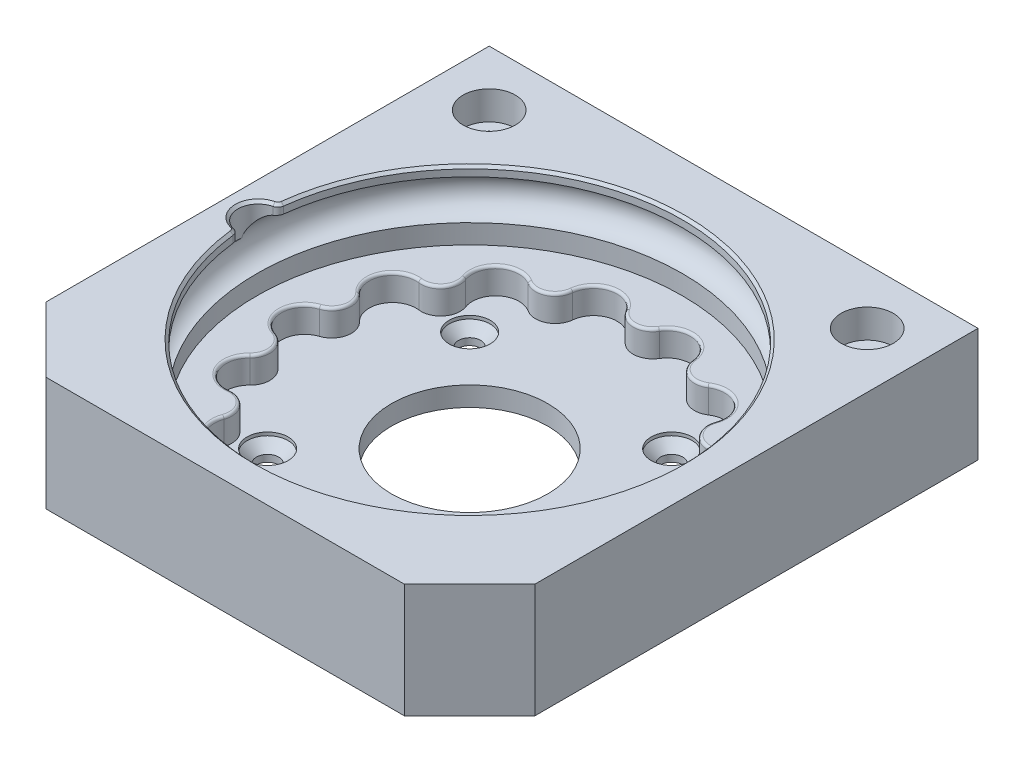
from build123d import *

# Parameters (mm, degrees)
SKETCH3_W                                           = 75
SKETCH3_H                                           = 75
SKETCH3_R                                           = 4.1
BOSS_EXTRUDE1_DEPTH                                 = 3
SKETCH4_W                                           = 75
SKETCH4_H                                           = 75
SKETCH4_R                                           = 3
BOSS_EXTRUDE2_DEPTH                                 = 4
SKETCH5_W                                           = 75
SKETCH5_H                                           = 75
SKETCH5_R                                           = 32.65
BOSS_EXTRUDE3_DEPTH                                 = 10.5
CHAMFER1_SIZE                                       = 10
SKETCH11_R                                          = 3.05
CUT_EXTRUDE2_START                                  = -4.5
SKETCH12_R                                          = 3.1
CUT_EXTRUDE2_DEPTH                                  = 4.5
FILLET2_R                                           = 1
SKETCH14_R                                          = 12
CUT_EXTRUDE3_DEPTH                                  = 56.845769925
CSK_FOR_M3_COUNTERSUNK_FLAT_HEAD_SCR_2_COUNT        = 2
CSK_FOR_M3_COUNTERSUNK_FLAT_HEAD_SCR_2_PITCH        = 31
CSK_FOR_M3_COUNTERSUNK_FLAT_HEAD_SCR_3_COUNT        = 2
CSK_FOR_M3_COUNTERSUNK_FLAT_HEAD_SCR_3_PITCH        = 43.840620434
CSK_FOR_M3_COUNTERSUNK_FLAT_HEAD_SCR_4_COUNT        = 2
CSK_FOR_M3_COUNTERSUNK_FLAT_HEAD_SCR_4_PITCH        = 31
CHAMFER2_SIZE                                       = 0.4
FILLET3_R                                           = 0.4
SKETCH24_W                                          = 75
SKETCH24_H                                          = 3
BOSS_EXTRUDE5_DEPTH                                 = 17.5
CBORE_FOR_M4_HEX_SOCKET_HEAD_CAP_SCREW1_D           = 4.5
CBORE_FOR_M4_HEX_SOCKET_HEAD_CAP_SCREW1_CBORE_D     = 8
CBORE_FOR_M4_HEX_SOCKET_HEAD_CAP_SCREW1_CBORE_DEPTH = 4.4


with BuildPart() as part:
    # Sketch3 → Boss-Extrude1 (new body)
    with BuildSketch(Plane(origin=(0, 0, 0), x_dir=(1, 0, 0), z_dir=(0, 1, 0))):
        Rectangle(SKETCH3_W, SKETCH3_H)
        with Locations(Location((0, 0, 0), (0, 0, 270))):
            Circle(SKETCH3_R, mode=Mode.SUBTRACT)
    extrude(amount=BOSS_EXTRUDE1_DEPTH)

    # Sketch4 → Boss-Extrude2 (add)
    # profile 1 of 15: a face of its own
    with BuildSketch(Plane(origin=(0, 3, 0), x_dir=(1, 0, 0), z_dir=(0, 1, 0))):
        Rectangle(SKETCH4_W, SKETCH4_H)
        with BuildLine():
            ThreePointArc((26.442208789, -3.408319866), (29.147644896, -3.81769999), (30.395474332, -6.252838244))
            ThreePointArc((30.395474332, -6.252838244), (28.561845083, -9.016817128), (25.302421485, -8.402054328))
            ThreePointArc((25.302421485, -8.402054328), (26.033152103, -12.5369053), (22.344792349, -14.543634511))
            ThreePointArc((22.344792349, -14.543634511), (24.219573885, -15.535873809), (24.969464657, -17.520063432))
            ThreePointArc((24.969464657, -17.520063432), (22.491548896, -20.474285504), (19.151179292, -18.548298619))
            ThreePointArc((19.151179292, -18.548298619), (18.015500229, -22.590722751), (13.821715745, -22.798403975))
            ThreePointArc((13.821715745, -22.798403975), (14.827351089, -23.883479748), (15.192133069, -25.317225188))
            ThreePointArc((15.192133069, -25.317225188), (12.043751311, -28.313553417), (9.206811167, -25.020824888))
            ThreePointArc((9.206811167, -25.020824888), (6.42965759, -28.170170503), (2.561078824, -26.537669928))
            ThreePointArc((2.561078824, -26.537669928), (2.888185977, -27.288592727), (3, -28.1))
            ThreePointArc((3, -28.1), (-0.811407273, -30.988185977), (-2.561078824, -26.537669928))
            ThreePointArc((-2.561078824, -26.537669928), (-6.42965759, -28.170170503), (-9.206811167, -25.020824888))
            ThreePointArc((-9.206811167, -25.020824888), (-9.195804841, -25.16884343), (-9.192133069, -25.317225188))
            ThreePointArc((-9.192133069, -25.317225188), (-13.625878509, -27.952443208), (-13.821715745, -22.798403975))
            ThreePointArc((-13.821715745, -22.798403975), (-18.015500229, -22.590722751), (-19.151179292, -18.548298619))
            ThreePointArc((-19.151179292, -18.548298619), (-24.314959105, -19.390532838), (-22.344792349, -14.543634511))
            ThreePointArc((-22.344792349, -14.543634511), (-26.033152103, -12.5369053), (-25.302421485, -8.402054328))
            ThreePointArc((-25.302421485, -8.402054328), (-30.320258069, -6.920401046), (-26.442208789, -3.408319866))
            ThreePointArc((-26.442208789, -3.408319866), (-28.894618926, 0), (-26.442208789, 3.408319866))
            ThreePointArc((-26.442208789, 3.408319866), (-30.320258069, 6.920401046), (-25.302421485, 8.402054328))
            ThreePointArc((-25.302421485, 8.402054328), (-26.033152103, 12.5369053), (-22.344792349, 14.543634511))
            ThreePointArc((-22.344792349, 14.543634511), (-24.314959105, 19.390532838), (-19.151179292, 18.548298619))
            ThreePointArc((-19.151179292, 18.548298619), (-18.015500229, 22.590722751), (-13.821715745, 22.798403975))
            ThreePointArc((-13.821715745, 22.798403975), (-13.625878509, 27.952443208), (-9.192133069, 25.317225188))
            ThreePointArc((-9.192133069, 25.317225188), (-9.195804841, 25.16884343), (-9.206811167, 25.020824888))
            ThreePointArc((-9.206811167, 25.020824888), (-6.42965759, 28.170170503), (-2.561078824, 26.537669928))
            ThreePointArc((-2.561078824, 26.537669928), (-0.811407273, 30.988185977), (3, 28.1))
            ThreePointArc((3, 28.1), (2.888185977, 27.288592727), (2.561078824, 26.537669928))
            ThreePointArc((2.561078824, 26.537669928), (6.42965759, 28.170170503), (9.206811167, 25.020824888))
            ThreePointArc((9.206811167, 25.020824888), (12.043751311, 28.313553417), (15.192133069, 25.317225188))
            ThreePointArc((15.192133069, 25.317225188), (14.827351089, 23.883479748), (13.821715745, 22.798403975))
            ThreePointArc((13.821715745, 22.798403975), (18.015500229, 22.590722751), (19.151179292, 18.548298619))
            ThreePointArc((19.151179292, 18.548298619), (22.491548896, 20.474285504), (24.969464657, 17.520063432))
            ThreePointArc((24.969464657, 17.520063432), (24.219573885, 15.535873809), (22.344792349, 14.543634511))
            ThreePointArc((22.344792349, 14.543634511), (26.033152103, 12.5369053), (25.302421485, 8.402054328))
            ThreePointArc((25.302421485, 8.402054328), (28.561845083, 9.016817128), (30.395474332, 6.252838244))
            ThreePointArc((30.395474332, 6.252838244), (29.147644896, 3.81769999), (26.442208789, 3.408319866))
            ThreePointArc((26.442208789, 3.408319866), (28.894618926, 0), (26.442208789, -3.408319866))
        make_face(mode=Mode.SUBTRACT)
    # profile 2 of 15: a face of its own
    with BuildSketch(Plane(origin=(0, 3, 0), x_dir=(1, 0, 0), z_dir=(0, 1, 0))):
        with Locations((21.969464657, 17.520063432)):
            Circle(SKETCH4_R)
    # profile 3 of 15: a face of its own
    with BuildSketch(Plane(origin=(0, 3, 0), x_dir=(1, 0, 0), z_dir=(0, 1, 0))):
        with Locations((27.395474332, 6.252838244)):
            Circle(SKETCH4_R)
    # profile 4 of 15: a face of its own
    with BuildSketch(Plane(origin=(0, 3, 0), x_dir=(1, 0, 0), z_dir=(0, 1, 0))):
        with Locations((27.395474332, -6.252838244)):
            Circle(SKETCH4_R)
    # profile 5 of 15: a face of its own
    with BuildSketch(Plane(origin=(0, 3, 0), x_dir=(1, 0, 0), z_dir=(0, 1, 0))):
        with Locations((21.969464657, -17.520063432)):
            Circle(SKETCH4_R)
    # profile 6 of 15: a face of its own
    with BuildSketch(Plane(origin=(0, 3, 0), x_dir=(1, 0, 0), z_dir=(0, 1, 0))):
        with Locations((12.192133069, -25.317225188)):
            Circle(SKETCH4_R)
    # profile 7 of 15: a face of its own
    with BuildSketch(Plane(origin=(0, 3, 0), x_dir=(1, 0, 0), z_dir=(0, 1, 0))):
        with Locations((0, -28.1)):
            Circle(SKETCH4_R)
    # profile 8 of 15: a face of its own
    with BuildSketch(Plane(origin=(0, 3, 0), x_dir=(1, 0, 0), z_dir=(0, 1, 0))):
        with Locations((-12.192133069, -25.317225188)):
            Circle(SKETCH4_R)
    # profile 9 of 15: a face of its own
    with BuildSketch(Plane(origin=(0, 3, 0), x_dir=(1, 0, 0), z_dir=(0, 1, 0))):
        with Locations((-21.969464657, -17.520063432)):
            Circle(SKETCH4_R)
    # profile 10 of 15: a face of its own
    with BuildSketch(Plane(origin=(0, 3, 0), x_dir=(1, 0, 0), z_dir=(0, 1, 0))):
        with Locations((-27.395474332, -6.252838244)):
            Circle(SKETCH4_R)
    # profile 11 of 15: a face of its own
    with BuildSketch(Plane(origin=(0, 3, 0), x_dir=(1, 0, 0), z_dir=(0, 1, 0))):
        with Locations((-27.395474332, 6.252838244)):
            Circle(SKETCH4_R)
    # profile 12 of 15: a face of its own
    with BuildSketch(Plane(origin=(0, 3, 0), x_dir=(1, 0, 0), z_dir=(0, 1, 0))):
        with Locations((-21.969464657, 17.520063432)):
            Circle(SKETCH4_R)
    # profile 13 of 15: a face of its own
    with BuildSketch(Plane(origin=(0, 3, 0), x_dir=(1, 0, 0), z_dir=(0, 1, 0))):
        with Locations((-12.192133069, 25.317225188)):
            Circle(SKETCH4_R)
    # profile 14 of 15: a face of its own
    with BuildSketch(Plane(origin=(0, 3, 0), x_dir=(1, 0, 0), z_dir=(0, 1, 0))):
        with Locations((0, 28.1)):
            Circle(SKETCH4_R)
    # profile 15 of 15: a face of its own
    with BuildSketch(Plane(origin=(0, 3, 0), x_dir=(1, 0, 0), z_dir=(0, 1, 0))):
        with Locations((12.192133069, 25.317225188)):
            Circle(SKETCH4_R)
    extrude(amount=BOSS_EXTRUDE2_DEPTH)

    # Sketch5 → Boss-Extrude3 (add)
    with BuildSketch(Plane(origin=(0, 7, 0), x_dir=(1, 0, 0), z_dir=(0, 1, 0))):
        Rectangle(SKETCH5_W, SKETCH5_H)
        with Locations(Location((0, 0, 0), (0, 0, 90))):
            Circle(SKETCH5_R, mode=Mode.SUBTRACT)
    extrude(amount=BOSS_EXTRUDE3_DEPTH)

    # Chamfer1
    chamfer1_edges = [part.edges().sort_by_distance(p)[0] for p in [
        (37.5, 8.75, 37.5),
        (-37.5, 8.75, 37.5),
    ]]
    chamfer(chamfer1_edges, length=CHAMFER1_SIZE)

    # Sketch11 → Cut-Revolve1 (revolve, cut)
    with BuildSketch(Plane.XY, mode=Mode.PRIVATE) as cut_revolve1_sk:
        with Locations((-32.45, 13)):
            Circle(SKETCH11_R)
    revolve(cut_revolve1_sk.sketch.rotate(Axis((0, 0, 0), (0, 1, 0)), 270), axis=Axis((0, 0, 0), (0, 1, 0)), mode=Mode.SUBTRACT)

    # Sketch12 → Cut-Extrude2 (cut)
    with BuildSketch(Plane(origin=(0, 17.5, 0), x_dir=(1, 0, 0), z_dir=(0, 1, 0)).offset(CUT_EXTRUDE2_START)):
        with Locations((-32.45, 0)):
            Circle(SKETCH12_R)
    extrude(amount=CUT_EXTRUDE2_DEPTH, mode=Mode.SUBTRACT)

    # Fillet2
    fillet2_edges = [part.edges().sort_by_distance(p)[0] for p in [
        (-32.502542373, 16.771717779, 3.099554694),
        (-32.502542373, 16.771717779, -3.099554694),
    ]]
    fillet(fillet2_edges, radius=FILLET2_R)

    # Sketch14 → Cut-Extrude3 (cut, through all)
    with BuildSketch(Plane.XZ):
        with Locations(Location((0, 0, 0), (0, 0, 270))):
            Circle(SKETCH14_R)
    extrude(amount=-CUT_EXTRUDE3_DEPTH, mode=Mode.SUBTRACT)

    # Sketch16 → CSK for M3 Countersunk Flat Head Screw1 (revolve, cut)
    with BuildSketch(Plane(origin=(-15.5, 3, -15.5), x_dir=(0, 0, 1), z_dir=(1, 0, 0))):
        Polygon((0, 0), (0, 3), (1.7, 3), (1.7, 1.95), (3.15, 0.5), (3.15, 0), align=None)
    csk_for_m3_countersunk_flat_head_screw1 = revolve(axis=Axis((-15.5, 9.35, -15.5), (0, -1, 0)), mode=Mode.SUBTRACT)

    # CSK for M3 Countersunk Flat Head Scr 2: CSK for M3 Countersunk Flat Head Screw1 ×2
    with Locations(*[(i * CSK_FOR_M3_COUNTERSUNK_FLAT_HEAD_SCR_2_PITCH, 0, 0) for i in range(1, CSK_FOR_M3_COUNTERSUNK_FLAT_HEAD_SCR_2_COUNT)]):
        add(csk_for_m3_countersunk_flat_head_screw1, mode=Mode.SUBTRACT)

    # CSK for M3 Countersunk Flat Head Scr 3: CSK for M3 Countersunk Flat Head Screw1 ×2
    with Locations(*[Vector(0.7071067811865476, 0, 0.7071067811865476) * (i * CSK_FOR_M3_COUNTERSUNK_FLAT_HEAD_SCR_3_PITCH) for i in range(1, CSK_FOR_M3_COUNTERSUNK_FLAT_HEAD_SCR_3_COUNT)]):
        add(csk_for_m3_countersunk_flat_head_screw1, mode=Mode.SUBTRACT)

    # CSK for M3 Countersunk Flat Head Scr 4: CSK for M3 Countersunk Flat Head Screw1 ×2
    with Locations(*[(0, 0, i * CSK_FOR_M3_COUNTERSUNK_FLAT_HEAD_SCR_4_PITCH) for i in range(1, CSK_FOR_M3_COUNTERSUNK_FLAT_HEAD_SCR_4_COUNT)]):
        add(csk_for_m3_countersunk_flat_head_screw1, mode=Mode.SUBTRACT)

    # Chamfer2
    chamfer2_edges = [part.edges().sort_by_distance(p)[0] for p in [
        (-35.55, 17.5, 0),
        (32.65, 17.5, 0),
        (-32.665461312, 17.5, -3.321237531),
        (-32.665461312, 17.5, 3.321237531),
    ]]
    chamfer(chamfer2_edges, length=CHAMFER2_SIZE)

    # Fillet3
    fillet3_edges = [part.edges().sort_by_distance(p)[0] for p in [
        (-26.033152103, 7, 12.5369053),
        (-28.894618926, 7, 0),
        (-26.033152103, 7, -12.5369053),
        (-18.015500229, 7, -22.590722751),
        (-6.42965759, 7, -28.170170503),
        (6.42965759, 7, -28.170170503),
        (18.015500229, 7, -22.590722751),
        (26.033152103, 7, -12.5369053),
        (28.894618926, 7, 0),
        (26.033152103, 7, 12.5369053),
        (18.015500229, 7, 22.590722751),
        (6.42965759, 7, 28.170170503),
        (-6.42965759, 7, 28.170170503),
        (-18.015500229, 7, 22.590722751),
        (-24.470690596, 7, 5.585275442),
        (-24.470690596, 7, -5.585275442),
        (-19.62397021, 7, -15.649594027),
        (-10.890481852, 7, -22.614318584),
        (0, 7, -25.1),
        (10.890481852, 7, -22.614318584),
        (19.62397021, 7, -15.649594027),
        (24.470690596, 7, -5.585275442),
        (24.470690596, 7, 5.585275442),
        (19.62397021, 7, 15.649594027),
        (10.890481852, 7, 22.614318584),
        (0, 7, 25.1),
        (-10.890481852, 7, 22.614318584),
        (-19.62397021, 7, 15.649594027),
    ]]
    fillet(fillet3_edges, radius=FILLET3_R)

    # Sketch24 → Boss-Extrude5 (add)
    with BuildSketch(Plane(origin=(0, 17.5, 0), x_dir=(1, 0, 0), z_dir=(0, 1, 0))):
        with Locations((0, 39)):
            Rectangle(SKETCH24_W, SKETCH24_H)
    extrude(amount=-BOSS_EXTRUDE5_DEPTH)

    # CBORE for M4 Hex Socket Head Cap Screw1 (through all)
    with Locations(Plane(origin=(0, 17.5, 0), x_dir=(1, 0, 0), z_dir=(0, 1, 0))):
        with Locations((-29, 32), (29, 32)):
            CounterBoreHole(CBORE_FOR_M4_HEX_SOCKET_HEAD_CAP_SCREW1_D / 2, CBORE_FOR_M4_HEX_SOCKET_HEAD_CAP_SCREW1_CBORE_D / 2, CBORE_FOR_M4_HEX_SOCKET_HEAD_CAP_SCREW1_CBORE_DEPTH)


solid = part.part
